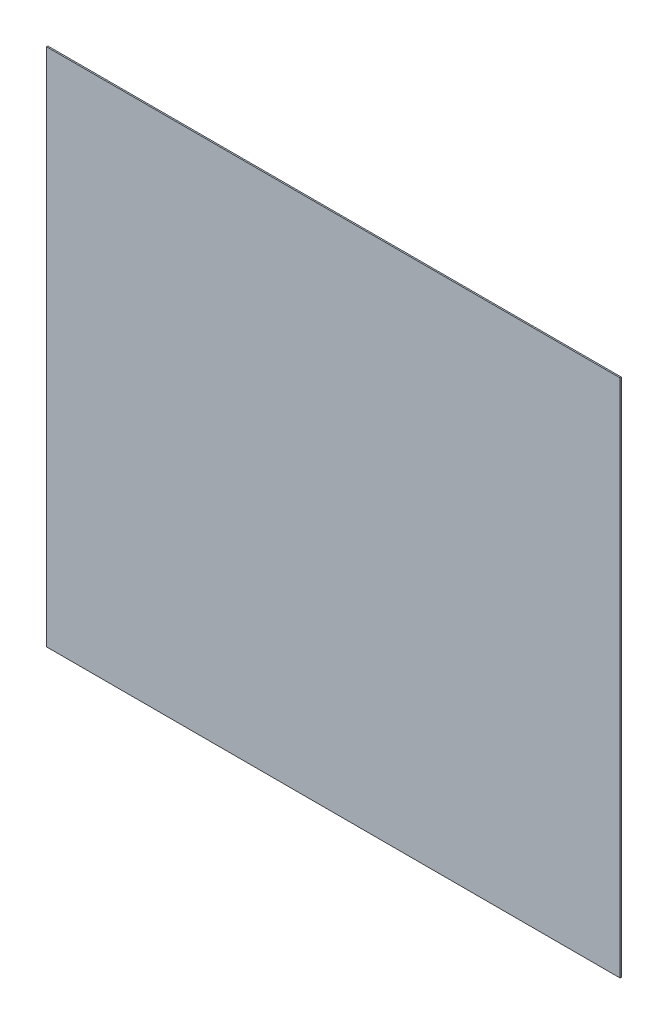
from build123d import *

# Parameters (mm, degrees)
PRESS_PANEL_ALT_1_START = 38.5
SKETCH1_W               = 640
SKETCH1_H               = 580
PRESS_PANEL_ALT_1_DEPTH = 1.5


with BuildPart() as part:
    # Sketch1 → PRESS_panel_alt_1 (new body)
    with BuildSketch(Plane.XY.offset(PRESS_PANEL_ALT_1_START)):
        with Locations((350, 410)):
            Rectangle(SKETCH1_W, SKETCH1_H)
    extrude(amount=PRESS_PANEL_ALT_1_DEPTH)


solid = part.part
